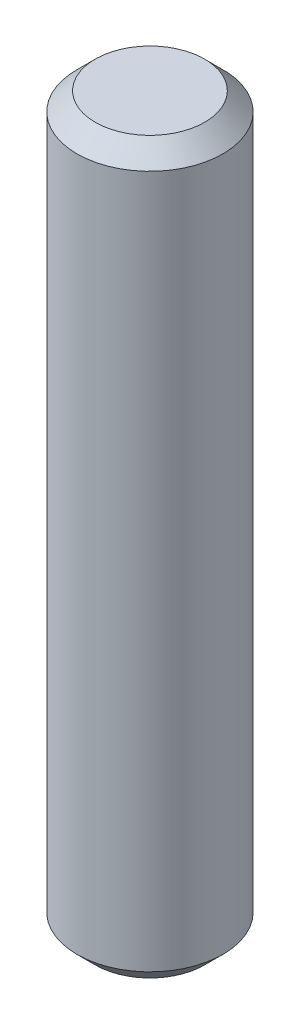
from build123d import *

# Parameters (mm, degrees)
SKETCH1_R           = 2
BOSS_EXTRUDE1_DEPTH = 20
CHAMFER1_SIZE       = 0.5
CHAMFER2_SIZE       = 0.5


with BuildPart() as part:
    # Sketch1 → Boss-Extrude1 (new body)
    with BuildSketch(Plane(origin=(0, 0, 0), x_dir=(1, 0, 0), z_dir=(0, 1, 0))):
        with Locations(Location((0, 0, 0), (0, 0, 270))):
            Circle(SKETCH1_R)
    extrude(amount=BOSS_EXTRUDE1_DEPTH)

    # Chamfer1
    chamfer1_edges = [part.edges().sort_by_distance(p)[0] for p in [
        (0, 20, -2),
    ]]
    chamfer(chamfer1_edges, length=CHAMFER1_SIZE)

    # Chamfer2
    chamfer2_edges = [part.edges().sort_by_distance(p)[0] for p in [
        (0, 0, -2),
    ]]
    chamfer(chamfer2_edges, length=CHAMFER2_SIZE)


solid = part.part
